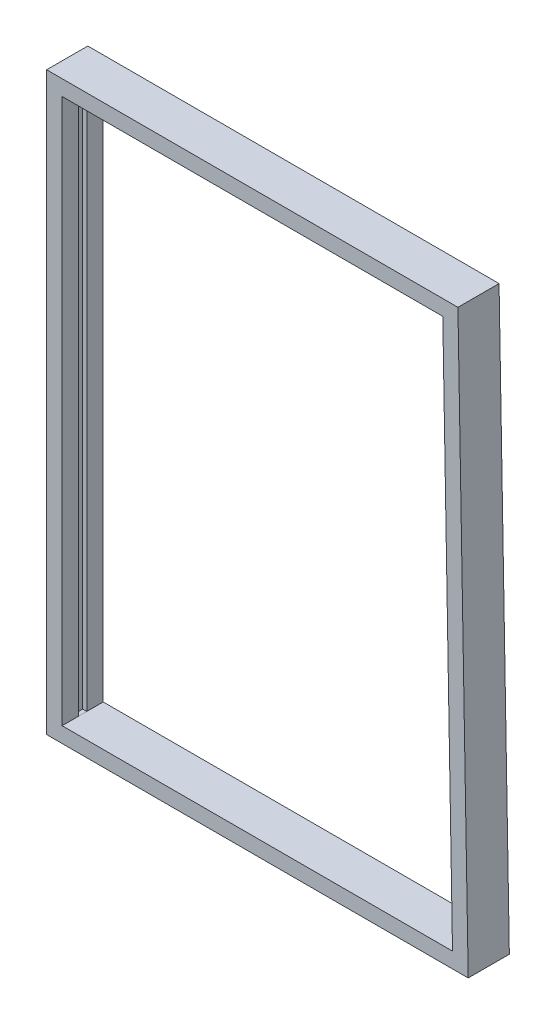
from build123d import *

# Parameters (mm, degrees)
BOSS_EXTRUDE1_DEPTH = 101.6
SKETCH3_W           = 20.32
SKETCH3_H           = 1346.2
CUT_EXTRUDE1_DEPTH  = 10.16
SKETCH4_W           = 20.32
SKETCH4_H           = 1346.2
CUT_EXTRUDE2_DEPTH  = 10.16


with BuildPart() as part:
    # Sketch2 → Boss-Extrude1 (new body)
    with BuildSketch(Plane.XY):
        Polygon((-520.7, 711.2), (495.299974685, 710.973195751), (520.7, -711.2), (-520.7, -711.2), align=None)
        Polygon((-482.6, 673.091493891), (457.874215728, 672.881549449), (481.913457595, -673.1), (-482.6, -673.1), align=None, mode=Mode.SUBTRACT)
    extrude(amount=BOSS_EXTRUDE1_DEPTH)

    # Sketch3 → Cut-Extrude1 (cut)
    with BuildSketch(Plane(origin=(469.742047624, 8.389596947, 0), x_dir=(0, 0, 1), z_dir=(-0.9998405481942395, -0.01785716065455791, 0))):
        with Locations((50.8, -8.500177591)):
            Rectangle(SKETCH3_W, SKETCH3_H)
    extrude(amount=-CUT_EXTRUDE1_DEPTH, mode=Mode.SUBTRACT)

    # Sketch4 → Cut-Extrude2 (cut)
    with BuildSketch(Plane(origin=(-482.6, 0, 0), x_dir=(0, 0, -1), z_dir=(1, 0, 0))):
        with Locations((-50.8, -0.004253054)):
            Rectangle(SKETCH4_W, SKETCH4_H)
    extrude(amount=-CUT_EXTRUDE2_DEPTH, mode=Mode.SUBTRACT)


solid = part.part
